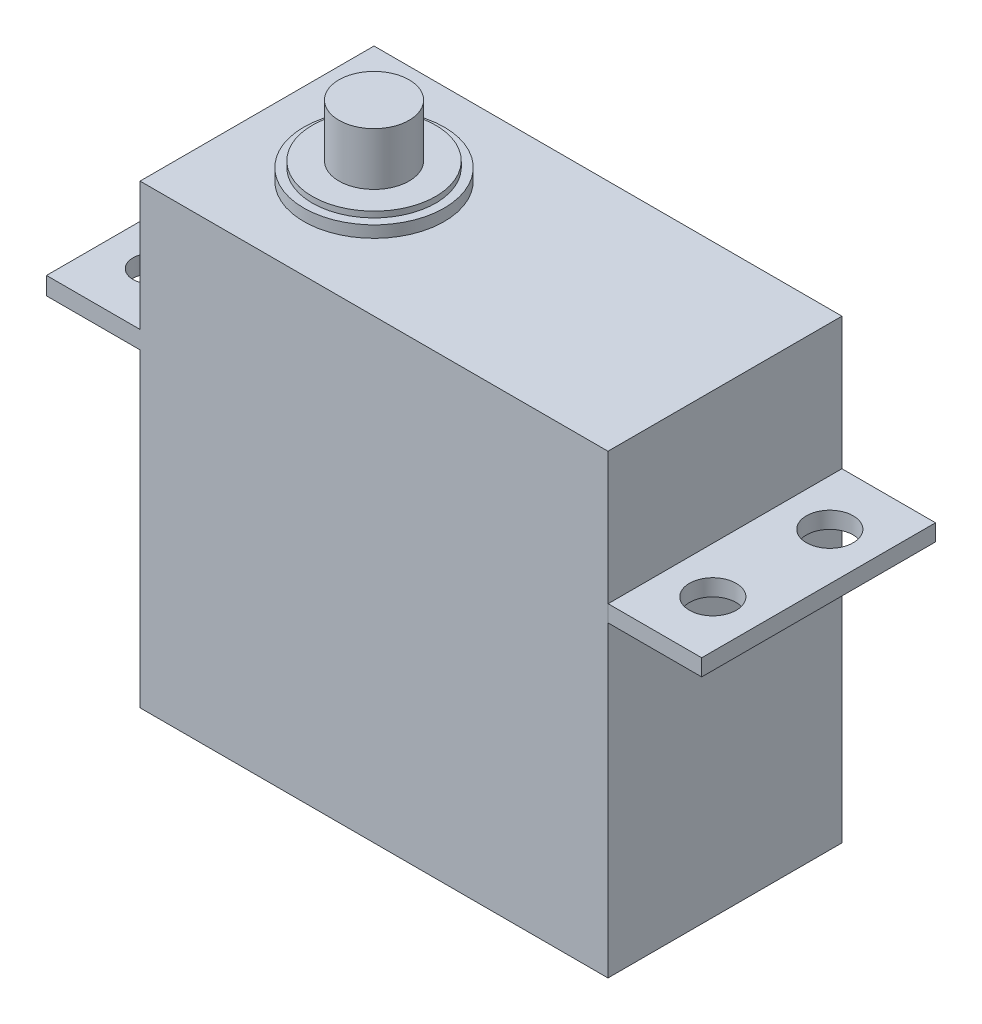
from build123d import *

# Parameters (mm, degrees)
SKETCH_1_W          = 40
SKETCH_1_H          = 39
EXTRUDE_1_DEPTH     = 20
SKETCH_3_R          = 6
EXTRUDE_2_DEPTH     = 1
SKETCH_4_R          = 3
EXTRUDE_4_DEPTH     = 25.5
SKETCH_5_W          = 20
SKETCH_5_H          = 1.515151515
EXTRUDE_5_DEPTH     = 8
SKETCH_6_W          = 19.988535735
SKETCH_6_H          = 1.420485619
EXTRUDE_8_DEPTH     = 8
SKETCH_7_R          = 1.710468594
SKETCH_7_R_2        = 1.604618823
SKETCH_7_R_3        = 2
CUT_EXTRUDE_2_DEPTH = 3
SKETCH_9_R          = 5.273794996
EXTRUDE_9_DEPTH     = 1.5


with BuildPart() as part:
    # 草图1 → 凸台-拉伸1 (new body)
    with BuildSketch(Plane.XY):
        Rectangle(SKETCH_1_W, SKETCH_1_H)
    extrude(amount=EXTRUDE_1_DEPTH)

    # 草图3 → 凸台-拉伸2 (add)
    with BuildSketch(Plane(origin=(0, 19.5, 0), x_dir=(1, 0, 0), z_dir=(0, 1, 0))):
        with Locations(Location((-10, -10, 0), (0, 0, 90))):
            Circle(SKETCH_3_R)
    extrude(amount=EXTRUDE_2_DEPTH)

    # 草图4 → 凸台-拉伸4 (add)
    with BuildSketch(Plane(origin=(0, 0, 0), x_dir=(1, 0, 0), z_dir=(0, 1, 0))):
        with Locations(Location((-10, -10, 0), (0, 0, 270))):
            Circle(SKETCH_4_R)
    extrude(amount=EXTRUDE_4_DEPTH)

    # 草图5 → 凸台-拉伸5 (add)
    with BuildSketch(Plane.ZY.offset(20)):
        with Locations((10, 7.757575758)):
            Rectangle(SKETCH_5_W, SKETCH_5_H)
    extrude(amount=EXTRUDE_5_DEPTH)

    # 草图6 → 凸台-拉伸8 (add)
    with BuildSketch(Plane(origin=(20, 0, 0), x_dir=(0, 0, -1), z_dir=(1, 0, 0))):
        with Locations((-9.994267868, 7.493661874)):
            Rectangle(SKETCH_6_W, SKETCH_6_H)
    extrude(amount=EXTRUDE_8_DEPTH)

    # 草图7 → 切除-拉伸2 (cut)
    with BuildSketch(Plane(origin=(0, 8.515151515, 0), x_dir=(1, 0, 0), z_dir=(0, 1, 0))):
        with Locations(Location((-24, -5, 0), (0, 0, 270))):
            Circle(SKETCH_7_R)
        with Locations(Location((-24, -15, 0), (0, 0, 270))):
            Circle(SKETCH_7_R_2)
        with Locations(Location((23.963224728, -5, 0), (0, 0, 270))):
            Circle(SKETCH_7_R_3)
        with Locations(Location((23.963224728, -15, 0), (0, 0, 270))):
            Circle(SKETCH_7_R_3)
    extrude(amount=-CUT_EXTRUDE_2_DEPTH, mode=Mode.SUBTRACT)

    # 草图9 → 凸台-拉伸9 (add)
    with BuildSketch(Plane(origin=(0, 19.5, 0), x_dir=(1, 0, 0), z_dir=(0, 1, 0))):
        with Locations(Location((-10, -10, 0), (0, 0, 270))):
            Circle(SKETCH_9_R)
    extrude(amount=EXTRUDE_9_DEPTH)


solid = part.part
